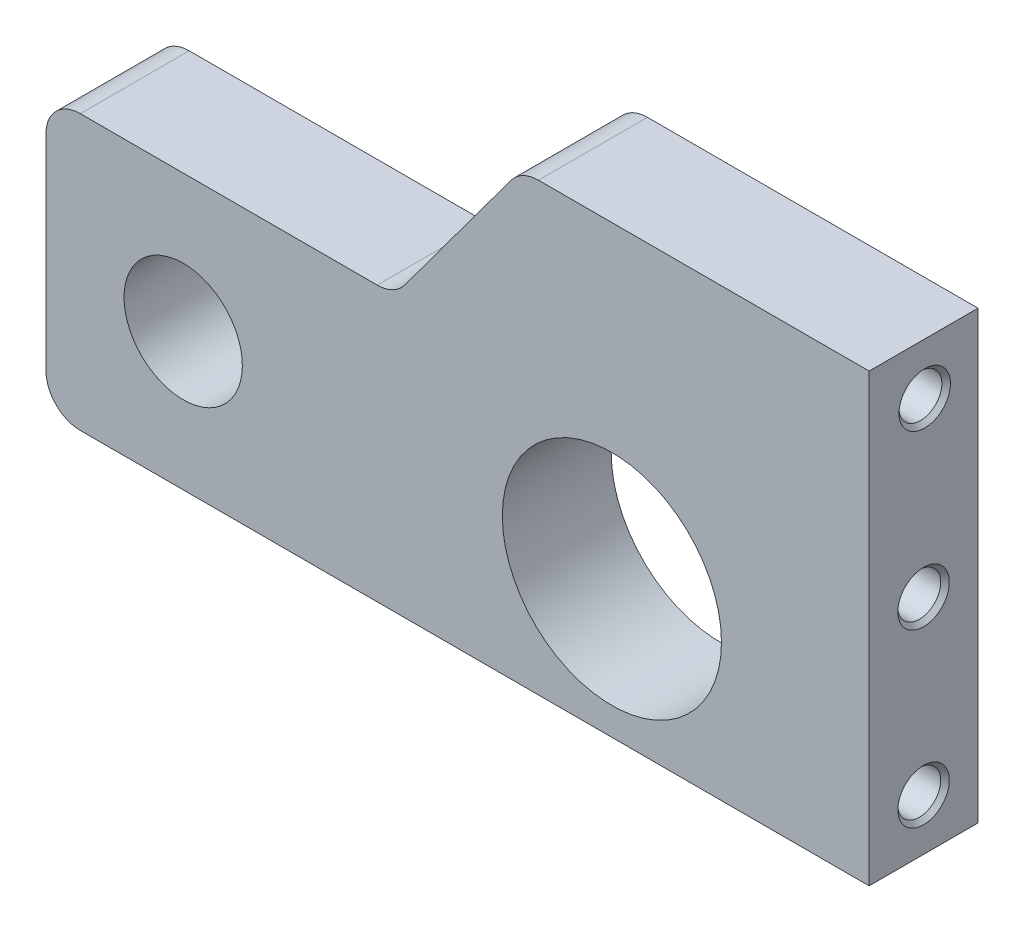
from build123d import *

# Parameters (mm, degrees)
SKETCH1_W           = 48
SKETCH1_H           = 16
BOSS_EXTRUDE1_DEPTH = 6.35
SKETCH1_6_R         = 6.39
SKETCH1_6_R_2       = 3.45
CUT_EXTRUDE1_DEPTH  = 6.35
FILLET1_R           = 2
SKETCH2_R           = 1.25
CUT_EXTRUDE2_DEPTH  = 5
BOSS_EXTRUDE2_DEPTH = 6.35
FILLET2_R           = 2
SKETCH4_R           = 1.25
CUT_EXTRUDE3_DEPTH  = 5
CHAMFER1_SIZE       = 0.25


with BuildPart() as part:
    # Sketch1 → Boss-Extrude1 (new body)
    with BuildSketch(Plane.XY):
        with Locations((24, 8)):
            Rectangle(SKETCH1_W, SKETCH1_H)
    extrude(amount=BOSS_EXTRUDE1_DEPTH)

    # Sketch1<6> → Cut-Extrude1 (cut)
    with BuildSketch(Plane.XY):
        with Locations((33, 8)):
            Circle(SKETCH1_6_R)
        with Locations((8, 8)):
            Circle(SKETCH1_6_R_2)
    extrude(amount=CUT_EXTRUDE1_DEPTH, mode=Mode.SUBTRACT)

    # Fillet1
    fillet1_edges = [part.edges().sort_by_distance(p)[0] for p in [
        (0, 16, 3.175),
        (0, 0, 3.175),
    ]]
    fillet(fillet1_edges, radius=FILLET1_R)

    # Sketch2 → Cut-Extrude2 (cut)
    with BuildSketch(Plane(origin=(48, 0, 0), x_dir=(0, 0, -1), z_dir=(1, 0, 0))):
        with Locations((-3.175, 13)):
            Circle(SKETCH2_R)
        with Locations((-3.175, 3)):
            Circle(SKETCH2_R)
    extrude(amount=-CUT_EXTRUDE2_DEPTH, mode=Mode.SUBTRACT)

    # Sketch3 → Boss-Extrude2 (add)
    with BuildSketch(Plane.XY.offset(6.35)):
        Polygon((20.326281713, 16), (48, 16), (48, 26), (27.712043107, 26), align=None)
    extrude(amount=-BOSS_EXTRUDE2_DEPTH)

    # Fillet2
    fillet2_edges = [part.edges().sort_by_distance(p)[0] for p in [
        (20.326281713, 16, 3.175),
        (27.712043107, 26, 3.175),
    ]]
    fillet(fillet2_edges, radius=FILLET2_R)

    # Sketch4 → Cut-Extrude3 (cut)
    with BuildSketch(Plane(origin=(48, 0, 0), x_dir=(0, 0, -1), z_dir=(1, 0, 0))):
        with Locations((-3.10572404, 23)):
            Circle(SKETCH4_R)
    extrude(amount=-CUT_EXTRUDE3_DEPTH, mode=Mode.SUBTRACT)

    # Chamfer1
    chamfer1_edges = [part.edges().sort_by_distance(p)[0] for p in [
        (48, 3, 4.425),
        (48, 13, 4.425),
        (48, 23, 4.35572404),
    ]]
    chamfer(chamfer1_edges, length=CHAMFER1_SIZE)


solid = part.part
